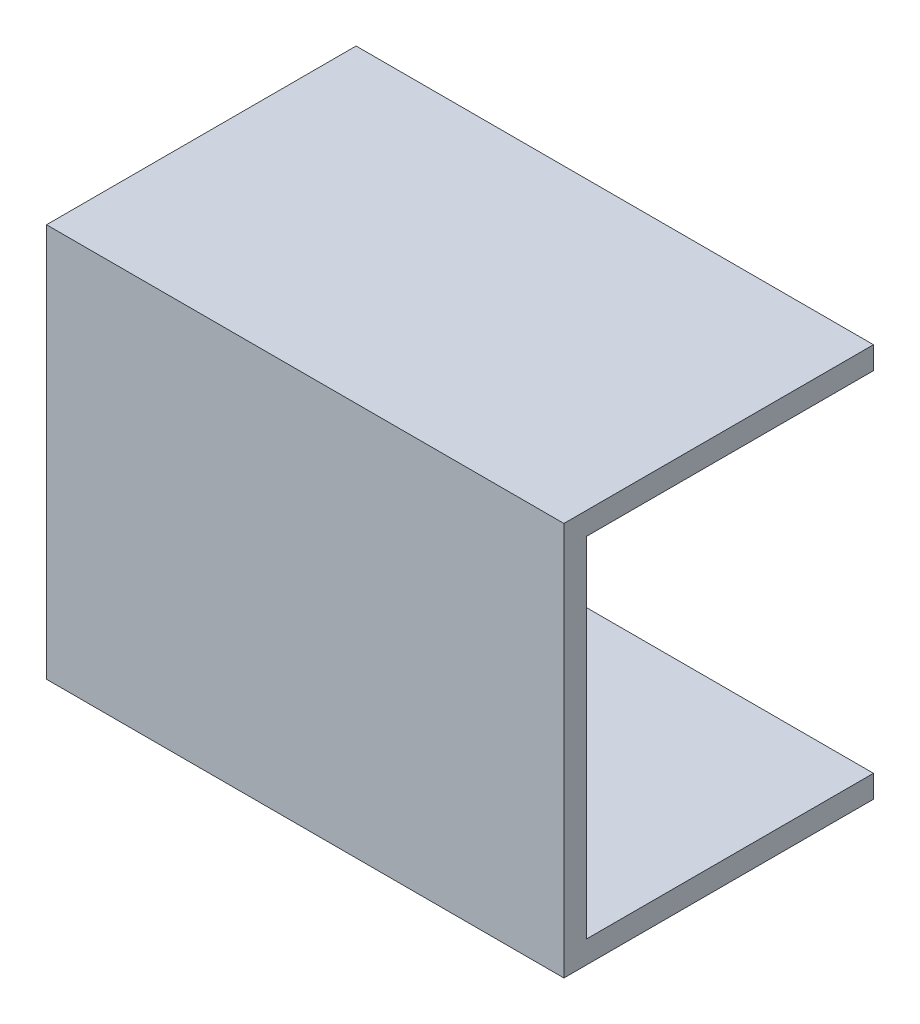
from build123d import *

# Parameters (mm, degrees)
EXTRUDE_THIN1_DEPTH = 46


with BuildPart() as part:
    # Sketch3 → Extrude-Thin1 (new body)
    with BuildSketch(Plane.ZY.offset(-268.297)):
        Polygon((3, -16.39), (28.524751964, -16.39), (28.524751964, -47.39), (3, -47.39), (3, -49.39), (30.524751964, -49.39), (30.524751964, -14.39), (3, -14.39), align=None)
    extrude(amount=EXTRUDE_THIN1_DEPTH)


solid = part.part
